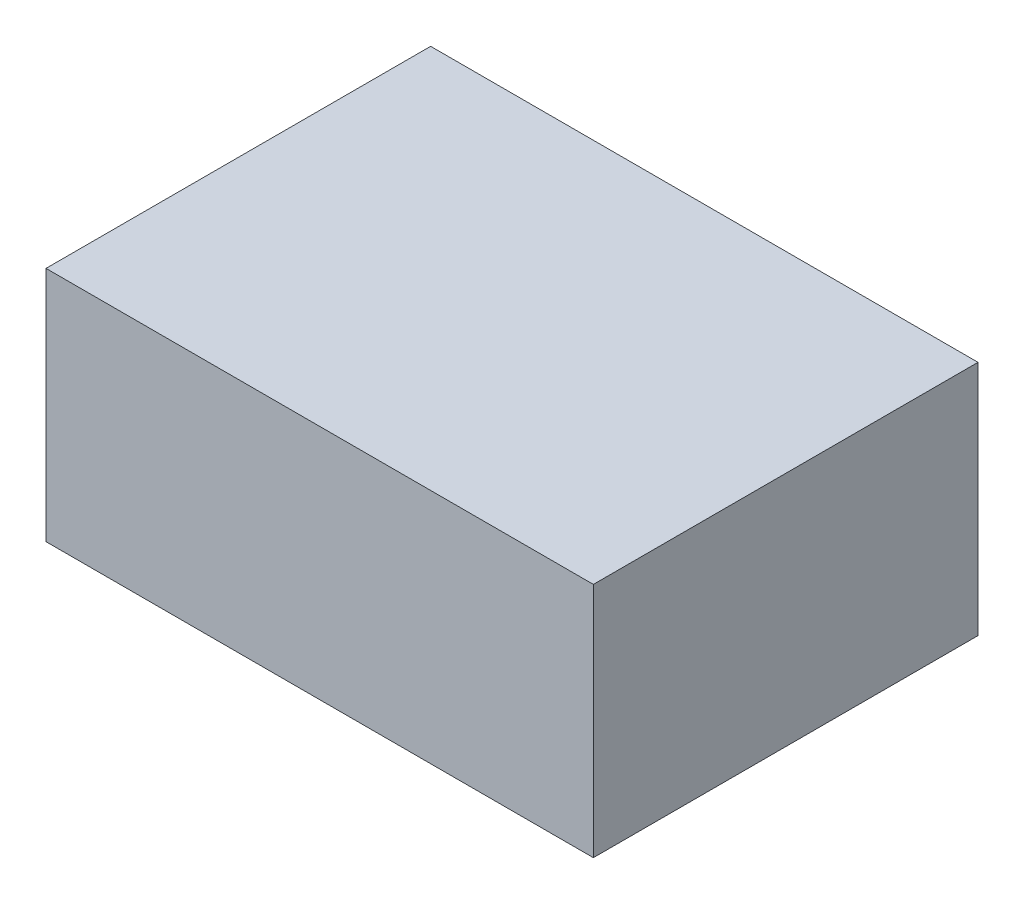
from build123d import *

# Parameters (mm, degrees)
SKETCH1_W           = 93.98
SKETCH1_H           = 66.04
BOSS_EXTRUDE1_DEPTH = 20.32


with BuildPart() as part:
    # Sketch1 → Boss-Extrude1 (new, symmetric)
    with BuildSketch(Plane(origin=(0, 0, 0), x_dir=(1, 0, 0), z_dir=(0, 1, 0))):
        Rectangle(SKETCH1_W, SKETCH1_H)
    extrude(amount=BOSS_EXTRUDE1_DEPTH, both=True)


solid = part.part
